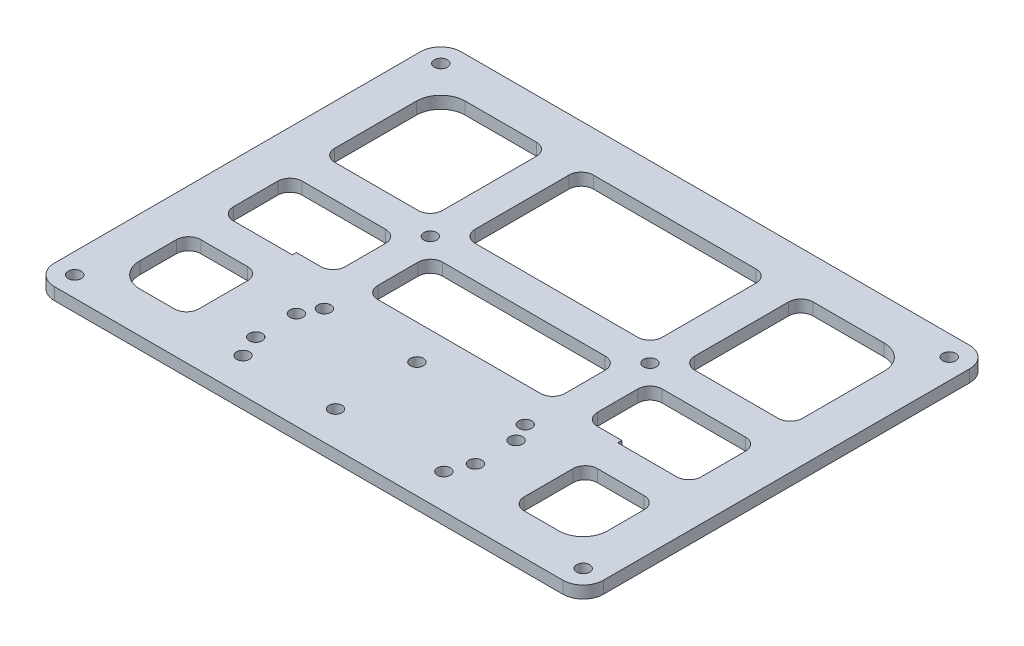
from build123d import *

# Parameters (mm, degrees)
SKETCH_1_R               = 1.6
EXTRUDE_1_DEPTH          = 3
SKETCH_2_R               = 1.6
CUT_EXTRUDE_1_DEPTH      = 85.055041491
SKETCH_3_R               = 1.6
CUT_EXTRUDE_2_DEPTH      = 85.055041491
CUT_EXTRUDE_3_DEPTH      = 85.055041491
CUT_EXTRUDE_3_DEPTH_BACK = 85.055041491


with BuildPart() as part:
    # 草图1 → 凸台-拉伸1 (new body)
    with BuildSketch(Plane(origin=(0, 0, 0), x_dir=(1, 0, 0), z_dir=(0, 1, 0))):
        with BuildLine():
            Line((-62.5, 50), (62.5, 50))
            ThreePointArc((62.5, 50), (66.035533906, 48.535533906), (67.5, 45))
            Line((67.5, 45), (67.5, -45))
            ThreePointArc((67.5, -45), (66.035533906, -48.535533906), (62.5, -50))
            Line((62.5, -50), (-62.5, -50))
            ThreePointArc((-62.5, -50), (-66.035533906, -48.535533906), (-67.5, -45))
            Line((-67.5, -45), (-67.5, 45))
            ThreePointArc((-67.5, 45), (-66.035533906, 48.535533906), (-62.5, 50))
        make_face()
        with Locations(Location((-62.5, 45, 0), (0, 0, 270))):
            Circle(SKETCH_1_R, mode=Mode.SUBTRACT)
        with Locations(Location((62.5, 45, 0), (0, 0, 270))):
            Circle(SKETCH_1_R, mode=Mode.SUBTRACT)
        with Locations(Location((-62.5, -45, 0), (0, 0, 270))):
            Circle(SKETCH_1_R, mode=Mode.SUBTRACT)
        with Locations(Location((62.5, -45, 0), (0, 0, 270))):
            Circle(SKETCH_1_R, mode=Mode.SUBTRACT)
    extrude(amount=EXTRUDE_1_DEPTH)

    # 草图2 → 切除-拉伸1 (cut, through all)
    with BuildSketch(Plane(origin=(0, 3, 0), x_dir=(1, 0, 0), z_dir=(0, 1, 0))):
        with Locations(Location((-24.625, -41.5, 0), (0, 0, 270))):
            Circle(SKETCH_2_R)
        with Locations(Location((-24.625, -21.5, 0), (0, 0, 270))):
            Circle(SKETCH_2_R)
        with Locations(Location((-1.875, -41.5, 0), (0, 0, 270))):
            Circle(SKETCH_2_R)
        with Locations(Location((-1.875, -21.5, 0), (0, 0, 270))):
            Circle(SKETCH_2_R)
        with Locations(Location((24.75, -41.5, 0), (0, 0, 270))):
            Circle(SKETCH_2_R)
        with Locations(Location((24.75, -21.5, 0), (0, 0, 270))):
            Circle(SKETCH_2_R)
    extrude(amount=-CUT_EXTRUDE_1_DEPTH, mode=Mode.SUBTRACT)

    # 草图3 → 切除-拉伸2 (cut, through all)
    with BuildSketch(Plane(origin=(0, 3, 0), x_dir=(1, 0, 0), z_dir=(0, 1, 0))):
        with Locations(Location((-27, -36, 0), (0, 0, 270))):
            Circle(SKETCH_3_R)
        with Locations(Location((27, -36, 0), (0, 0, 90))):
            Circle(SKETCH_3_R)
        with Locations(Location((-27, 6.92, 0), (0, 0, 270))):
            Circle(SKETCH_3_R)
        with Locations(Location((27, 6.92, 0), (0, 0, 90))):
            Circle(SKETCH_3_R)
        with Locations(Location((-27, -26, 0), (0, 0, 270))):
            Circle(SKETCH_3_R)
        with Locations(Location((27, -26, 0), (0, 0, 90))):
            Circle(SKETCH_3_R)
    extrude(amount=-CUT_EXTRUDE_2_DEPTH, mode=Mode.SUBTRACT)

    # 草图6 → 切除-拉伸3 (cut, two sides: drawn at the far end of the back side and taken through both)
    with BuildSketch(Plane(origin=(0, 3, 0), x_dir=(1, 0, 0), z_dir=(0, 1, 0)).offset(-CUT_EXTRUDE_3_DEPTH_BACK)):
        with BuildLine():
            ThreePointArc((-54.5, 10.92), (-56.621320344, 11.798679656), (-57.5, 13.92))
            Line((-57.5, 13.92), (-57.5, 34))
            ThreePointArc((-57.5, 34), (-55.742640687, 38.242640687), (-51.5, 40))
            Line((-51.5, 40), (-34, 40))
            ThreePointArc((-34, 40), (-31.878679656, 39.121320344), (-31, 37))
            Line((-31, 37), (-31, 13.92))
            ThreePointArc((-31, 13.92), (-31.878679656, 11.798679656), (-34, 10.92))
            Line((-34, 10.92), (-54.5, 10.92))
        make_face()
        with BuildLine():
            ThreePointArc((-20, 10.92), (-22.121320344, 11.798679656), (-23, 13.92))
            Line((-23, 13.92), (-23, 37))
            ThreePointArc((-23, 37), (-22.121320344, 39.121320344), (-20, 40))
            Line((-20, 40), (20, 40))
            ThreePointArc((20, 40), (22.121320344, 39.121320344), (23, 37))
            Line((23, 37), (23, 13.92))
            ThreePointArc((23, 13.92), (22.121320344, 11.798679656), (20, 10.92))
            Line((20, 10.92), (-20, 10.92))
        make_face()
        with BuildLine():
            ThreePointArc((31, 37), (31.878679656, 39.121320344), (34, 40))
            Line((34, 40), (51.5, 40))
            ThreePointArc((51.5, 40), (55.742640687, 38.242640687), (57.5, 34))
            Line((57.5, 34), (57.5, 13.92))
            ThreePointArc((57.5, 13.92), (56.621320344, 11.798679656), (54.5, 10.92))
            Line((54.5, 10.92), (34, 10.92))
            ThreePointArc((34, 10.92), (31.878679656, 11.798679656), (31, 13.92))
            Line((31, 13.92), (31, 37))
        make_face()
        with BuildLine():
            Line((57.5, -11), (57.5, -0.08))
            ThreePointArc((57.5, -0.08), (56.621320344, 2.041320344), (54.5, 2.92))
            Line((54.5, 2.92), (34, 2.92))
            ThreePointArc((34, 2.92), (31.878679656, 2.041320344), (31, -0.08))
            Line((31, -0.08), (31, -10))
            ThreePointArc((31, -10), (31.878679656, -12.121320344), (34, -13))
            Line((34, -13), (40, -13))
            Line((40, -13), (40, -14))
            Line((40, -14), (54.5, -14))
            ThreePointArc((54.5, -14), (56.621320344, -13.121320344), (57.5, -11))
        make_face()
        with BuildLine():
            ThreePointArc((-23, -0.08), (-22.121320344, 2.041320344), (-20, 2.92))
            Line((-20, 2.92), (20, 2.92))
            ThreePointArc((20, 2.92), (22.121320344, 2.041320344), (23, -0.08))
            Line((23, -0.08), (23, -10))
            ThreePointArc((23, -10), (22.121320344, -12.121320344), (20, -13))
            Line((20, -13), (-20, -13))
            ThreePointArc((-20, -13), (-22.121320344, -12.121320344), (-23, -10))
            Line((-23, -10), (-23, -0.08))
        make_face()
        with BuildLine():
            Line((-31, -0.08), (-31, -10))
            ThreePointArc((-31, -10), (-31.878679656, -12.121320344), (-34, -13))
            Line((-34, -13), (-40, -13))
            Line((-40, -13), (-40, -14))
            Line((-40, -14), (-54.5, -14))
            ThreePointArc((-54.5, -14), (-56.621320344, -13.121320344), (-57.5, -11))
            Line((-57.5, -11), (-57.5, -0.08))
            ThreePointArc((-57.5, -0.08), (-56.621320344, 2.041320344), (-54.5, 2.92))
            Line((-54.5, 2.92), (-34, 2.92))
            ThreePointArc((-34, 2.92), (-31.878679656, 2.041320344), (-31, -0.08))
        make_face()
        with BuildLine():
            ThreePointArc((-54.5, -22), (-56.621320344, -22.878679656), (-57.5, -25))
            Line((-57.5, -25), (-57.5, -34))
            ThreePointArc((-57.5, -34), (-55.742640687, -38.242640687), (-51.5, -40))
            Line((-51.5, -40), (-43, -40))
            ThreePointArc((-43, -40), (-40.878679656, -39.121320344), (-40, -37))
            Line((-40, -37), (-40, -30.568485257))
            Line((-40, -30.568485257), (-40, -25))
            ThreePointArc((-40, -25), (-40.878679656, -22.878679656), (-43, -22))
            Line((-43, -22), (-54.5, -22))
        make_face()
        with BuildLine():
            Line((57.5, -34), (57.5, -25))
            ThreePointArc((57.5, -25), (56.621320344, -22.878679656), (54.5, -22))
            Line((54.5, -22), (43, -22))
            ThreePointArc((43, -22), (40.878679656, -22.878679656), (40, -25))
            Line((40, -25), (40, -37))
            ThreePointArc((40, -37), (40.878679656, -39.121320344), (43, -40))
            Line((43, -40), (51.5, -40))
            ThreePointArc((51.5, -40), (55.742640687, -38.242640687), (57.5, -34))
        make_face()
    extrude(amount=CUT_EXTRUDE_3_DEPTH + CUT_EXTRUDE_3_DEPTH_BACK, mode=Mode.SUBTRACT)


solid = part.part
